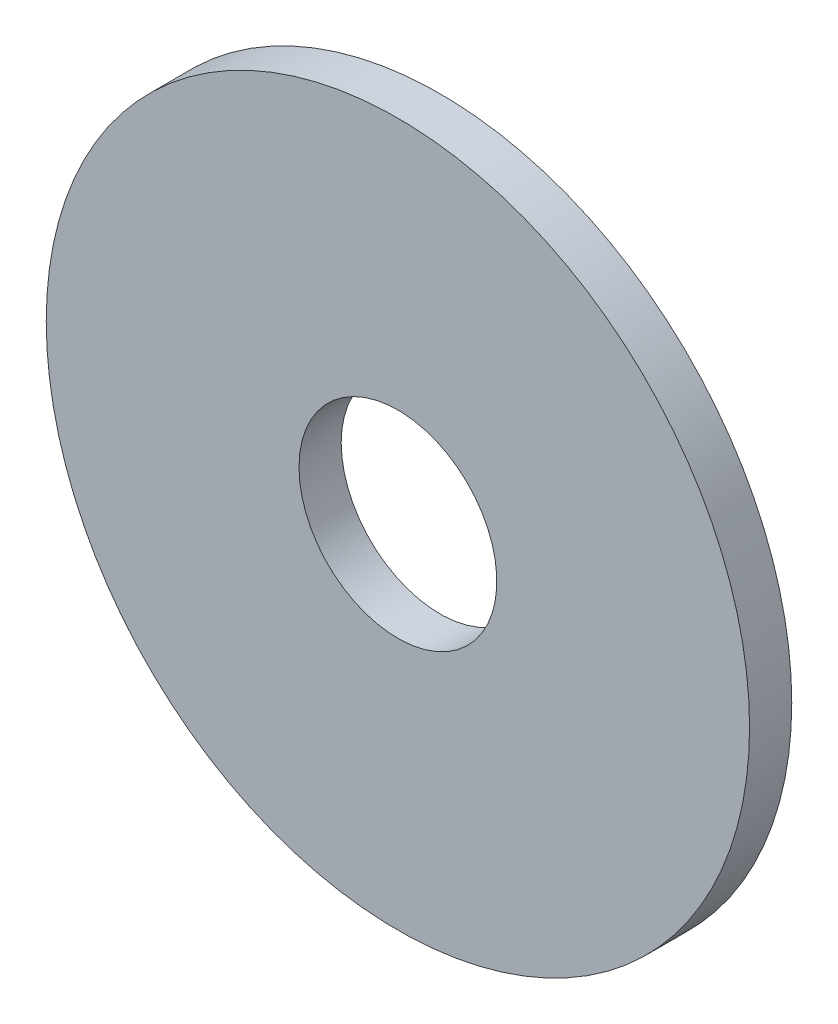
from build123d import *

# Parameters (mm, degrees)
SKETCH1_R           = 12.7
SKETCH1_R_2         = 3.571875
BOSS_EXTRUDE1_DEPTH = 0.762


with BuildPart() as part:
    # Sketch1 → Boss-Extrude1 (new, symmetric)
    with BuildSketch(Plane.XY):
        Circle(SKETCH1_R)
        Circle(SKETCH1_R_2, mode=Mode.SUBTRACT)
    extrude(amount=BOSS_EXTRUDE1_DEPTH, both=True)


solid = part.part
